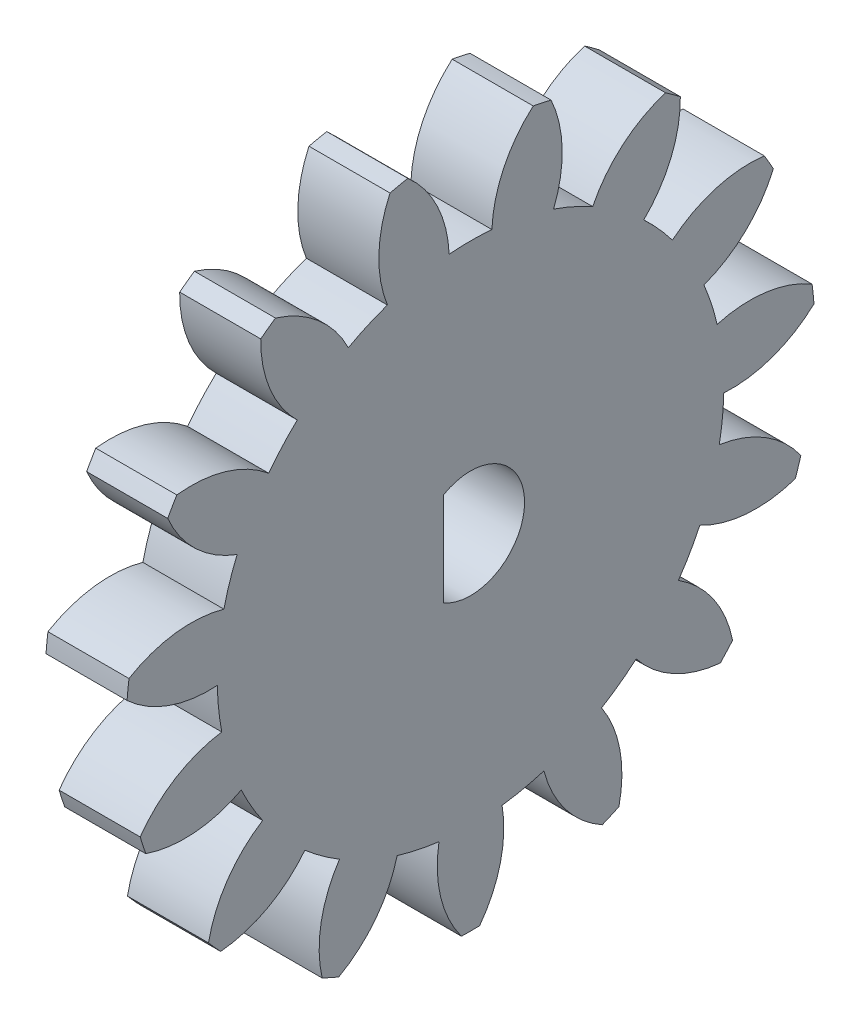
from build123d import *

# Parameters (mm, degrees)
BASPROSKE_W        = 3
BASPROSKE_H        = 12.75
TOOTHCUT_DEPTH     = 19.27908641
TEETHCUTS_COUNT    = 15
TEETHCUTS_ANGLE    = 336
BORSKE_R           = 2
BORE_DEPTH         = 50.0000508
BOSS_EXTRU_1_START = -3
BOSS_EXTRU_1_DEPTH = 3


with BuildPart() as part:
    # BasProSke → Base-Revolve (revolve)
    with BuildSketch(Plane(origin=(0, 0, 0), x_dir=(1, 0, 0), z_dir=(0, 1, 0)), mode=Mode.PRIVATE) as base_revolve_sk:
        with Locations((1.5, 6.375)):
            Rectangle(BASPROSKE_W, BASPROSKE_H)
    revolve(base_revolve_sk.sketch.rotate(Axis((-10, 0, 0), (1, 0, 0)), 180), axis=Axis((-10, 0, 0), (1, 0, 0)))

    # TooCutSke → ToothCut (cut, through all)
    with BuildSketch(Plane(origin=(0, 0, 0), x_dir=(0, 0, -1), z_dir=(1, 0, 0))):
        with BuildLine():
            ThreePointArc((0.791546546, 9.340520867), (0, 9.374), (-0.791546546, 9.340520867))
            ThreePointArc((-0.791546546, 9.340520867), (-1.235070734, 11.110218102), (-2.344732916, 12.558386549))
            ThreePointArc((-2.344732916, 12.558386549), (0, 12.7754), (2.344732916, 12.558386549))
            ThreePointArc((2.344732916, 12.558386549), (1.235070734, 11.110218102), (0.791546546, 9.340520867))
        make_face()
    toothcut = extrude(amount=TOOTHCUT_DEPTH, mode=Mode.SUBTRACT)

    # TeethCuts: ToothCut ×15 about axis
    teethcuts_axis = Axis((-10, 0, 0), (1, 0, 0))
    for i in range(1, TEETHCUTS_COUNT):
        add(toothcut.rotate(teethcuts_axis, i * TEETHCUTS_ANGLE / (TEETHCUTS_COUNT - 1)), mode=Mode.SUBTRACT)

    # BorSke → Bore (cut, symmetric)
    with BuildSketch(Plane(origin=(0, 0, 0), x_dir=(0, 0, -1), z_dir=(1, 0, 0))):
        with Locations(Location((0, 0, 0), (0, 0, 180))):
            Circle(BORSKE_R)
    extrude(amount=BORE_DEPTH, both=True, mode=Mode.SUBTRACT)

    # Esquisse1 → Boss.-Extru.1 (add)
    with BuildSketch(Plane.ZY.offset(BOSS_EXTRU_1_START)):
        with BuildLine():
            Line((1, 1.732050808), (1, -1.732050808))
            ThreePointArc((1, -1.732050808), (2, 0), (1, 1.732050808))
        make_face()
    extrude(amount=BOSS_EXTRU_1_DEPTH)


solid = part.part
